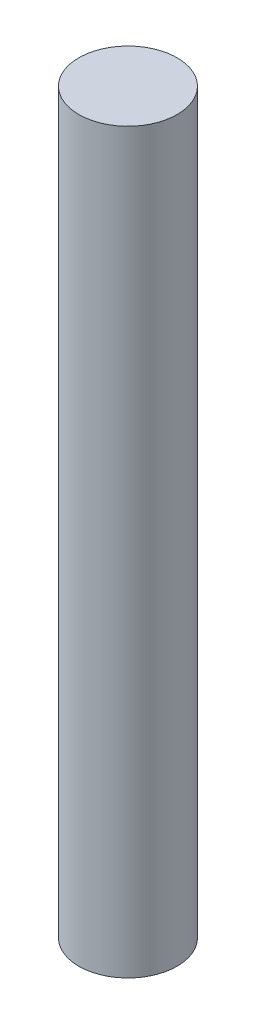
from build123d import *

# Parameters (mm, degrees)
SKETCH2_R           = 2
BOSS_EXTRUDE1_DEPTH = 30


with BuildPart() as part:
    # Sketch2 → Boss-Extrude1 (new body)
    with BuildSketch(Plane(origin=(0, 0, 0), x_dir=(1, 0, 0), z_dir=(0, 1, 0))):
        with Locations(Location((0, 0, 0), (0, 0, 270))):
            Circle(SKETCH2_R)
    extrude(amount=BOSS_EXTRUDE1_DEPTH)


solid = part.part
